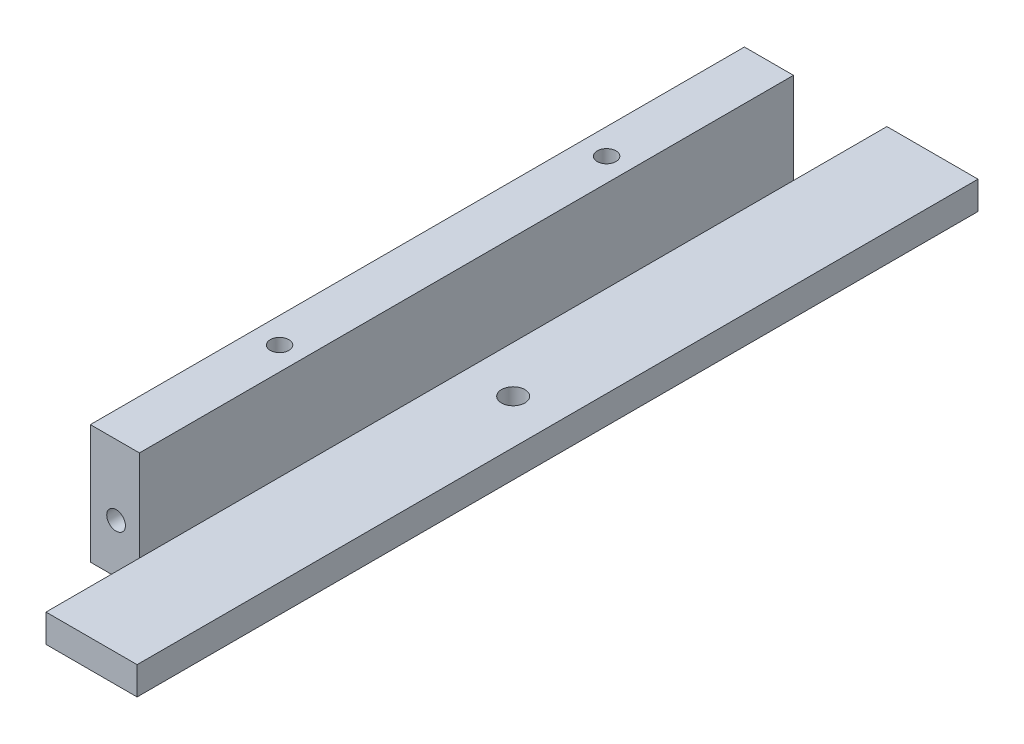
from build123d import *

# Parameters (mm, degrees)
DODANIE_WYCI_GNI_CIE1_DEPTH = 180
SZKIC2_W                    = 10.5
SZKIC2_H                    = 20
WYTNIJ_WYCI_GNI_CIE1_DEPTH  = 183.921602059
SZKIC3_R                    = 2
WYTNIJ_WYCI_GNI_CIE2_DEPTH  = 10
SZKIC4_R                    = 2
WYTNIJ_WYCI_GNI_CIE3_DEPTH  = 10
SZKIC5_R                    = 2.5
WYTNIJ_WYCI_GNI_CIE4_DEPTH  = 10


with BuildPart() as part:
    # Szkic1 → Dodanie-wyciągnięcie1 (new body)
    with BuildSketch(Plane.XY):
        Polygon((9.75, -9.75), (9.75, -15.75), (-20.25, -15.75), (-20.25, 9.75), (-9.75, 9.75), (-9.75, -9.75), align=None)
    extrude(amount=DODANIE_WYCI_GNI_CIE1_DEPTH)

    # Szkic2 → Wytnij-wyciągnięcie1 (cut, through all)
    with BuildSketch(Plane(origin=(0, 9.75, 0), x_dir=(1, 0, 0), z_dir=(0, 1, 0))):
        with Locations((-15, -170)):
            Rectangle(SZKIC2_W, SZKIC2_H)
    wytnij_wyci_gni_cie1 = extrude(amount=-WYTNIJ_WYCI_GNI_CIE1_DEPTH, mode=Mode.SUBTRACT)

    # Lustro1: Wytnij-wyciągnięcie1 across plane
    add(wytnij_wyci_gni_cie1.mirror(Plane.XY.offset(90)), mode=Mode.SUBTRACT)

    # Szkic3 → Wytnij-wyciągnięcie2 (cut)
    with BuildSketch(Plane(origin=(0, 9.75, 0), x_dir=(1, 0, 0), z_dir=(0, 1, 0))):
        with Locations(Location((-14.75, -55, 0), (0, 0, 180))):
            Circle(SZKIC3_R)
        with Locations(Location((-14.75, -125, 0), (0, 0, 180))):
            Circle(SZKIC3_R)
    extrude(amount=-WYTNIJ_WYCI_GNI_CIE2_DEPTH, mode=Mode.SUBTRACT)

    # Szkic4 → Wytnij-wyciągnięcie3 (cut)
    with BuildSketch(Plane.XY.offset(160)):
        with Locations((-14.75, -5.25)):
            Circle(SZKIC4_R)
    wytnij_wyci_gni_cie3 = extrude(amount=-WYTNIJ_WYCI_GNI_CIE3_DEPTH, mode=Mode.SUBTRACT)

    # Lustro2: Wytnij-wyciągnięcie3 across plane
    add(wytnij_wyci_gni_cie3.mirror(Plane.XY.offset(90)), mode=Mode.SUBTRACT)

    # Szkic5 → Wytnij-wyciągnięcie4 (cut)
    with BuildSketch(Plane(origin=(0, -9.75, 0), x_dir=(1, 0, 0), z_dir=(0, 1, 0))):
        with Locations(Location((0.25, -90, 0), (0, 0, 270))):
            Circle(SZKIC5_R)
    extrude(amount=-WYTNIJ_WYCI_GNI_CIE4_DEPTH, mode=Mode.SUBTRACT)


solid = part.part
